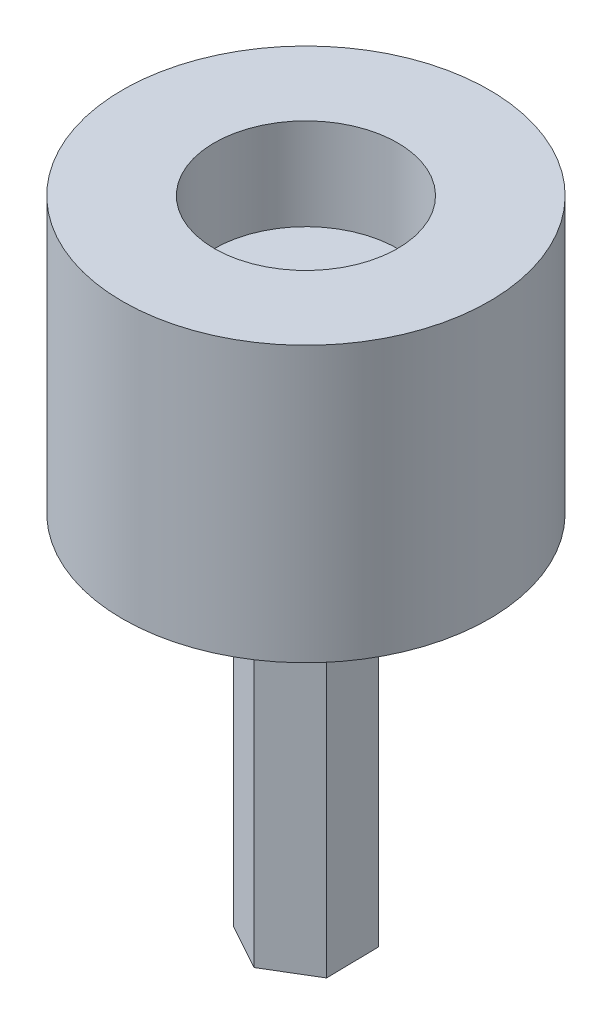
from build123d import *

# Parameters (mm, degrees)
SKETCH1_R           = 10
BOSS_EXTRUDE1_DEPTH = 15
SKETCH2_R           = 5
CUT_EXTRUDE1_DEPTH  = 5
BOSS_EXTRUDE2_DEPTH = 20
FILLET2_R           = 2


with BuildPart() as part:
    # Sketch1 → Boss-Extrude1 (new body)
    with BuildSketch(Plane(origin=(0, 0, 0), x_dir=(1, 0, 0), z_dir=(0, 1, 0))):
        with Locations(Location((-10.491071429, 0.647321429, 0), (0, 0, 270))):
            Circle(SKETCH1_R)
    extrude(amount=BOSS_EXTRUDE1_DEPTH)

    # Sketch2 → Cut-Extrude1 (cut)
    with BuildSketch(Plane(origin=(0, 15, 0), x_dir=(1, 0, 0), z_dir=(0, 1, 0))):
        with Locations(Location((-10.491071429, 0.647321429, 0), (0, 0, 270))):
            Circle(SKETCH2_R)
    extrude(amount=-CUT_EXTRUDE1_DEPTH, mode=Mode.SUBTRACT)

    # Sketch3 → Boss-Extrude2 (add)
    with BuildSketch(Plane(origin=(0, 0, 0), x_dir=(-1, 0, 0), z_dir=(0, -1, 0))):
        Polygon((8.015436801, 2.132099703), (7.96739841, -0.754251912), (10.443033038, -2.239030187), (12.966706056, -0.837456846), (13.014744447, 2.04889477), (10.539109819, 3.533673044), align=None)
    extrude(amount=BOSS_EXTRUDE2_DEPTH)

    # Fillet2
    fillet2_edges = [part.edges().sort_by_distance(p)[0] for p in [
        (-9.27727331, 0, -2.832886373),
        (-7.991417606, 0, -0.688923895),
        (-9.205215724, 0, 1.496641049),
        (-11.704869547, 0, 1.538243516),
        (-12.990725252, 0, -0.605718962),
        (-11.776927133, 0, -2.791283907),
    ]]
    fillet(fillet2_edges, radius=FILLET2_R)


solid = part.part
